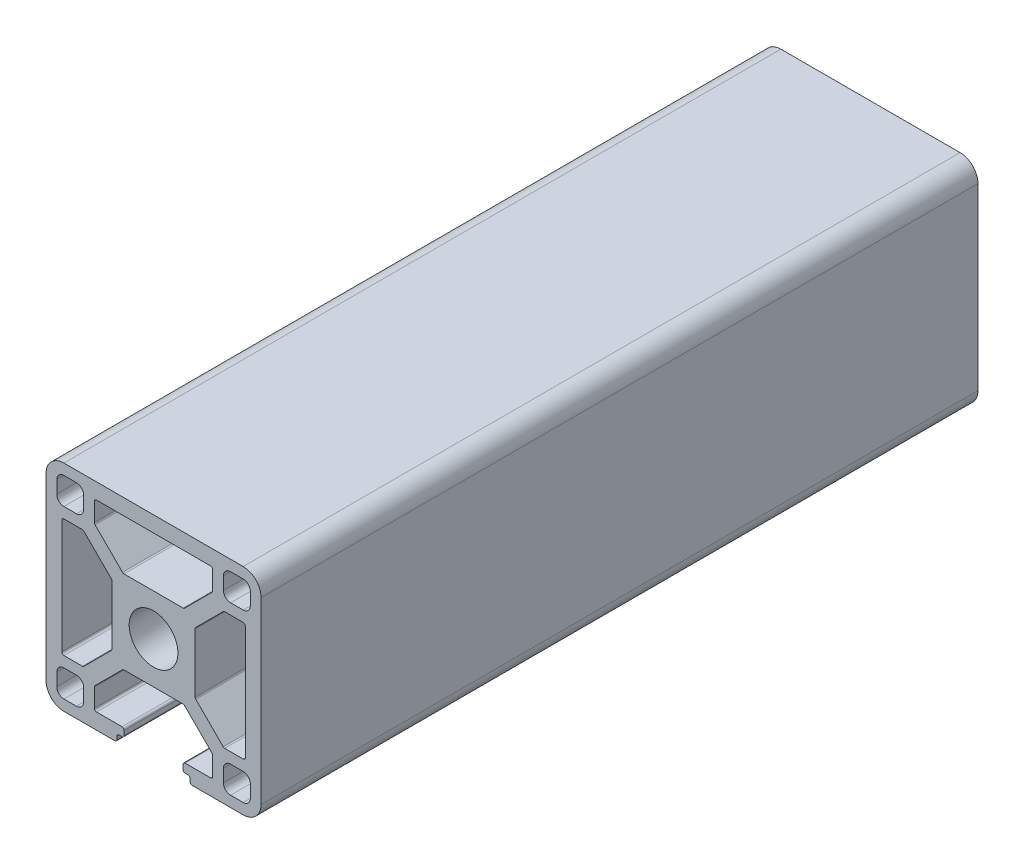
from build123d import *

# Parameters (mm, degrees)
SKETCH_1_R      = 3.399999997
EXTRUDE_1_DEPTH = 50


with BuildPart() as part:
    # 草图1 → 凸台-拉伸1 (new, symmetric)
    with BuildSketch(Plane.XY):
        with BuildLine():
            Line((12.49999999, 14.999999989), (-12.49999999, 14.999999989))
            ThreePointArc((-12.49999999, 14.999999989), (-14.267766942, 14.267766942), (-14.999999989, 12.49999999))
            Line((-14.999999989, 12.49999999), (-14.999999989, -12.49999999))
            ThreePointArc((-14.999999989, -12.49999999), (-14.267766942, -14.267766942), (-12.49999999, -14.999999989))
            Line((-12.49999999, -14.999999989), (-5.399999996, -14.999999989))
            ThreePointArc((-5.399999996, -14.999999989), (-5.187867962, -14.912132023), (-5.099999996, -14.699999989))
            Line((-5.099999996, -14.699999989), (-5.099999996, -14.299999989))
            ThreePointArc((-5.099999996, -14.299999989), (-5.01213203, -14.087867955), (-4.799999996, -13.999999989))
            Line((-4.799999996, -13.999999989), (-4.399999997, -13.999999989))
            ThreePointArc((-4.399999997, -13.999999989), (-4.187867962, -13.912132024), (-4.099999997, -13.69999999))
            Line((-4.099999997, -13.69999999), (-4.099999997, -13.09999999))
            ThreePointArc((-4.099999997, -13.09999999), (-4.187867962, -12.887867956), (-4.399999997, -12.79999999))
            Line((-4.399999997, -12.79999999), (-7.949999994, -12.79999999))
            ThreePointArc((-7.949999994, -12.79999999), (-8.162132028, -12.712132025), (-8.249999994, -12.499999991))
            Line((-8.249999994, -12.499999991), (-8.249999994, -9.92989898))
            ThreePointArc((-8.249999994, -9.92989898), (-8.227163854, -9.81509395), (-8.162132028, -9.717766946))
            Line((-8.162132028, -9.717766946), (-4.332233044, -5.887867961))
            ThreePointArc((-4.332233044, -5.887867961), (-4.234906039, -5.822836136), (-4.12010101, -5.799999996))
            Line((-4.12010101, -5.799999996), (4.12010101, -5.799999996))
            ThreePointArc((4.12010101, -5.799999996), (4.234906039, -5.822836136), (4.332233044, -5.887867961))
            Line((4.332233044, -5.887867961), (8.162132028, -9.717766946))
            ThreePointArc((8.162132028, -9.717766946), (8.227163854, -9.81509395), (8.249999994, -9.92989898))
            Line((8.249999994, -9.92989898), (8.249999994, -12.499999991))
            ThreePointArc((8.249999994, -12.499999991), (8.162132028, -12.712132025), (7.949999994, -12.79999999))
            Line((7.949999994, -12.79999999), (4.399999997, -12.79999999))
            ThreePointArc((4.399999997, -12.79999999), (4.187867962, -12.887867956), (4.099999997, -13.09999999))
            Line((4.099999997, -13.09999999), (4.099999997, -13.69999999))
            ThreePointArc((4.099999997, -13.69999999), (4.187867962, -13.912132024), (4.399999997, -13.999999989))
            Line((4.399999997, -13.999999989), (4.799999996, -13.999999989))
            ThreePointArc((4.799999996, -13.999999989), (5.01213203, -14.087867955), (5.099999996, -14.299999989))
            Line((5.099999996, -14.299999989), (5.099999996, -14.699999989))
            ThreePointArc((5.099999996, -14.699999989), (5.187867962, -14.912132023), (5.399999996, -14.999999989))
            Line((5.399999996, -14.999999989), (12.49999999, -14.999999989))
            ThreePointArc((12.49999999, -14.999999989), (14.267766942, -14.267766942), (14.999999989, -12.49999999))
            Line((14.999999989, -12.49999999), (14.999999989, 12.49999999))
            ThreePointArc((14.999999989, 12.49999999), (14.267766942, 14.267766942), (12.49999999, 14.999999989))
        make_face()
        Circle(SKETCH_1_R, mode=Mode.SUBTRACT)
        with BuildLine():
            Line((7.949999994, 12.79999999), (-7.949999994, 12.79999999))
            ThreePointArc((-7.949999994, 12.79999999), (-8.162132028, 12.712132025), (-8.249999994, 12.499999991))
            Line((-8.249999994, 12.499999991), (-8.249999994, 9.92989898))
            ThreePointArc((-8.249999994, 9.92989898), (-8.227163854, 9.81509395), (-8.162132028, 9.717766946))
            Line((-8.162132028, 9.717766946), (-4.332233044, 5.887867961))
            ThreePointArc((-4.332233044, 5.887867961), (-4.234906039, 5.822836136), (-4.12010101, 5.799999996))
            Line((-4.12010101, 5.799999996), (4.12010101, 5.799999996))
            ThreePointArc((4.12010101, 5.799999996), (4.234906039, 5.822836136), (4.332233044, 5.887867961))
            Line((4.332233044, 5.887867961), (8.162132028, 9.717766946))
            ThreePointArc((8.162132028, 9.717766946), (8.227163853, 9.81509395), (8.249999994, 9.92989898))
            Line((8.249999994, 9.92989898), (8.249999994, 12.499999991))
            ThreePointArc((8.249999994, 12.499999991), (8.162132028, 12.712132025), (7.949999994, 12.79999999))
        make_face(mode=Mode.SUBTRACT)
        with BuildLine():
            Line((10.749999992, 9.749999993), (12.499999991, 9.749999993))
            ThreePointArc((12.499999991, 9.749999993), (13.207106771, 10.042893211), (13.49999999, 10.749999992))
            Line((13.49999999, 10.749999992), (13.49999999, 12.49999999))
            ThreePointArc((13.49999999, 12.49999999), (13.207106771, 13.207106771), (12.49999999, 13.49999999))
            Line((12.49999999, 13.49999999), (10.749999992, 13.49999999))
            ThreePointArc((10.749999992, 13.49999999), (10.042893211, 13.207106771), (9.749999993, 12.499999991))
            Line((9.749999993, 12.499999991), (9.749999993, 10.749999992))
            ThreePointArc((9.749999993, 10.749999992), (10.042893211, 10.042893211), (10.749999992, 9.749999993))
        make_face(mode=Mode.SUBTRACT)
        with BuildLine():
            Line((-13.49999999, 12.49999999), (-13.49999999, 10.749999992))
            ThreePointArc((-13.49999999, 10.749999992), (-13.207106771, 10.042893211), (-12.499999991, 9.749999993))
            Line((-12.499999991, 9.749999993), (-10.749999992, 9.749999993))
            ThreePointArc((-10.749999992, 9.749999993), (-10.042893211, 10.042893211), (-9.749999993, 10.749999992))
            Line((-9.749999993, 10.749999992), (-9.749999993, 12.499999991))
            ThreePointArc((-9.749999993, 12.499999991), (-10.042893211, 13.207106771), (-10.749999992, 13.49999999))
            Line((-10.749999992, 13.49999999), (-12.49999999, 13.49999999))
            ThreePointArc((-12.49999999, 13.49999999), (-13.207106771, 13.207106771), (-13.49999999, 12.49999999))
        make_face(mode=Mode.SUBTRACT)
        with BuildLine():
            Line((9.749999993, -10.749999992), (9.749999993, -12.499999991))
            ThreePointArc((9.749999993, -12.499999991), (10.042893211, -13.207106771), (10.749999992, -13.49999999))
            Line((10.749999992, -13.49999999), (12.49999999, -13.49999999))
            ThreePointArc((12.49999999, -13.49999999), (13.207106771, -13.207106771), (13.49999999, -12.49999999))
            Line((13.49999999, -12.49999999), (13.49999999, -10.749999992))
            ThreePointArc((13.49999999, -10.749999992), (13.207106771, -10.042893211), (12.499999991, -9.749999993))
            Line((12.499999991, -9.749999993), (10.749999992, -9.749999993))
            ThreePointArc((10.749999992, -9.749999993), (10.042893211, -10.042893211), (9.749999993, -10.749999992))
        make_face(mode=Mode.SUBTRACT)
        with BuildLine():
            Line((-5.799999996, -4.12010101), (-5.799999996, 4.12010101))
            ThreePointArc((-5.799999996, 4.12010101), (-5.822836136, 4.234906039), (-5.887867961, 4.332233044))
            Line((-5.887867961, 4.332233044), (-9.717766946, 8.162132028))
            ThreePointArc((-9.717766946, 8.162132028), (-9.81509395, 8.227163854), (-9.92989898, 8.249999994))
            Line((-9.92989898, 8.249999994), (-12.499999991, 8.249999994))
            ThreePointArc((-12.499999991, 8.249999994), (-12.712132025, 8.162132028), (-12.79999999, 7.949999994))
            Line((-12.79999999, 7.949999994), (-12.79999999, -7.949999994))
            ThreePointArc((-12.79999999, -7.949999994), (-12.712132025, -8.162132028), (-12.499999991, -8.249999994))
            Line((-12.499999991, -8.249999994), (-9.92989898, -8.249999994))
            ThreePointArc((-9.92989898, -8.249999994), (-9.81509395, -8.227163854), (-9.717766946, -8.162132028))
            Line((-9.717766946, -8.162132028), (-5.887867961, -4.332233044))
            ThreePointArc((-5.887867961, -4.332233044), (-5.822836136, -4.234906039), (-5.799999996, -4.12010101))
        make_face(mode=Mode.SUBTRACT)
        with BuildLine():
            Line((5.799999996, 4.12010101), (5.799999996, -4.12010101))
            ThreePointArc((5.799999996, -4.12010101), (5.822836136, -4.234906039), (5.887867961, -4.332233044))
            Line((5.887867961, -4.332233044), (9.717766946, -8.162132028))
            ThreePointArc((9.717766946, -8.162132028), (9.81509395, -8.227163854), (9.92989898, -8.249999994))
            Line((9.92989898, -8.249999994), (12.499999991, -8.249999994))
            ThreePointArc((12.499999991, -8.249999994), (12.712132025, -8.162132028), (12.79999999, -7.949999994))
            Line((12.79999999, -7.949999994), (12.79999999, 7.949999994))
            ThreePointArc((12.79999999, 7.949999994), (12.712132025, 8.162132028), (12.499999991, 8.249999994))
            Line((12.499999991, 8.249999994), (9.92989898, 8.249999994))
            ThreePointArc((9.92989898, 8.249999994), (9.81509395, 8.227163854), (9.717766946, 8.162132028))
            Line((9.717766946, 8.162132028), (5.887867961, 4.332233044))
            ThreePointArc((5.887867961, 4.332233044), (5.822836136, 4.234906039), (5.799999996, 4.12010101))
        make_face(mode=Mode.SUBTRACT)
        with BuildLine():
            Line((-10.749999992, -9.749999993), (-12.499999991, -9.749999993))
            ThreePointArc((-12.499999991, -9.749999993), (-13.207106771, -10.042893211), (-13.49999999, -10.749999992))
            Line((-13.49999999, -10.749999992), (-13.49999999, -12.49999999))
            ThreePointArc((-13.49999999, -12.49999999), (-13.207106771, -13.207106771), (-12.49999999, -13.49999999))
            Line((-12.49999999, -13.49999999), (-10.749999992, -13.49999999))
            ThreePointArc((-10.749999992, -13.49999999), (-10.042893211, -13.207106771), (-9.749999993, -12.499999991))
            Line((-9.749999993, -12.499999991), (-9.749999993, -10.749999992))
            ThreePointArc((-9.749999993, -10.749999992), (-10.042893211, -10.042893211), (-10.749999992, -9.749999993))
        make_face(mode=Mode.SUBTRACT)
    extrude(amount=EXTRUDE_1_DEPTH, both=True)


solid = part.part
